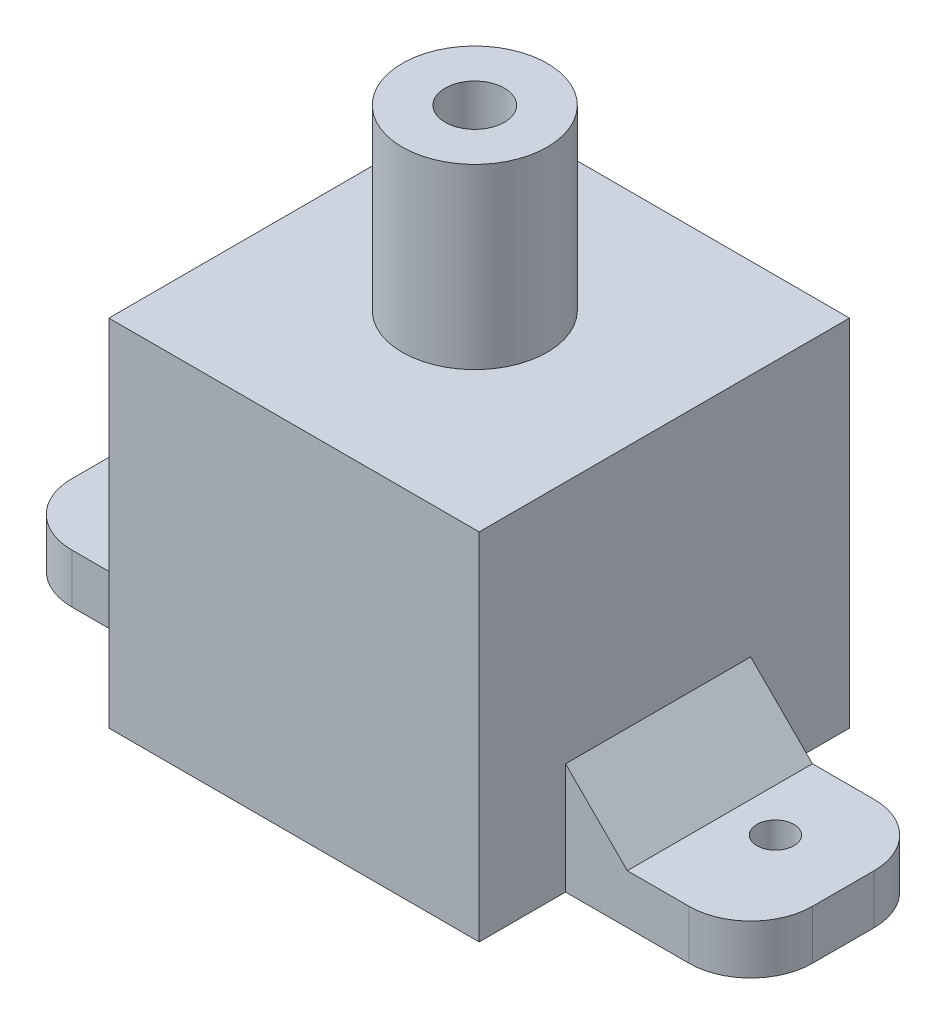
from build123d import *

# Parameters (mm, degrees)
SKETCH_1_W               = 30
SKETCH_1_H               = 30
EXTRUDE_289_DEPTH        = 28.77
SKETCH_2_R               = 5.875
EXTRUDE_2_DEPTH          = 14.4
EXTRUDE_4_DEPTH          = 4
CUT_EXTRUDE_2_DEPTH      = 53.090646066
CUT_EXTRUDE_2_DEPTH_BACK = 53.090646066
SKETCH_6_R               = 1.5
CHAMFER_2_SIZE           = 5
CHAMFER_3_SIZE           = 5
SKETCH_4_R               = 2.4
CUT_EXTRUDE_3_DEPTH      = 8


with BuildPart() as part:
    # Эскиз1 → Extrude 289 (new body)
    with BuildSketch(Plane(origin=(0, 0, 0), x_dir=(1, 0, 0), z_dir=(0, 1, 0))):
        with Locations((0.713469456, -0.356734728)):
            Rectangle(SKETCH_1_W, SKETCH_1_H)
    extrude(amount=EXTRUDE_289_DEPTH)

    # Эскиз2 → Бобышка-Вытянуть2 (add)
    with BuildSketch(Plane(origin=(0, 28.77, 0), x_dir=(1, 0, 0), z_dir=(0, 1, 0))):
        with Locations(Location((0, 0, 0), (0, 0, 270))):
            Circle(SKETCH_2_R)
    extrude(amount=EXTRUDE_2_DEPTH)

    # Эскиз5 → Бобышка-Вытянуть4 (add)
    with BuildSketch(Plane.XZ):
        with BuildLine():
            Line((15.713469456, 8.356734728), (25.713469456, 8.356734728))
            ThreePointArc((25.713469456, 8.356734728), (29.249003362, 6.892268634), (30.713469456, 3.356734728))
            Line((30.713469456, 3.356734728), (30.713469456, -1.643265272))
            ThreePointArc((30.713469456, -1.643265272), (29.249003362, -5.178799178), (25.713469456, -6.643265272))
            Line((25.713469456, -6.643265272), (15.713469456, -6.643265272))
            Line((15.713469456, -6.643265272), (15.713469456, 8.356734728))
        make_face()
        with BuildLine():
            Line((-14.286530544, 8.356734728), (-24.286530544, 8.356734728))
            ThreePointArc((-24.286530544, 8.356734728), (-27.82206445, 6.892268634), (-29.286530544, 3.356734728))
            Line((-29.286530544, 3.356734728), (-29.286530544, -1.643265272))
            ThreePointArc((-29.286530544, -1.643265272), (-27.82206445, -5.178799178), (-24.286530544, -6.643265272))
            Line((-24.286530544, -6.643265272), (-14.286530544, -6.643265272))
            Line((-14.286530544, -6.643265272), (-14.286530544, 8.356734728))
        make_face()
    extrude(amount=-EXTRUDE_4_DEPTH)

    # Эскиз6 → Вырез-Вытянуть2 (cut, two sides: drawn at the far end of the back side and taken through both)
    with BuildSketch(Plane(origin=(0, 4, 0), x_dir=(1, 0, 0), z_dir=(0, 1, 0)).offset(-CUT_EXTRUDE_2_DEPTH_BACK)):
        with Locations(Location((24.213469456, 0.143265272, 0), (0, 0, 270))):
            Circle(SKETCH_6_R)
        with Locations(Location((-22.786530544, 0.143265272, 0), (0, 0, 270))):
            Circle(SKETCH_6_R)
    extrude(amount=CUT_EXTRUDE_2_DEPTH + CUT_EXTRUDE_2_DEPTH_BACK, mode=Mode.SUBTRACT)

    # Фаска2
    chamfer_2_edges = [part.edges().sort_by_distance(p)[0] for p in [
        (15.713469456, 4, 0.856734728),
    ]]
    chamfer(chamfer_2_edges, length=CHAMFER_2_SIZE)

    # Фаска3
    chamfer_3_edges = [part.edges().sort_by_distance(p)[0] for p in [
        (-14.286530544, 4, 0.856734728),
    ]]
    chamfer(chamfer_3_edges, length=CHAMFER_3_SIZE)

    # Эскиз4 → Вырез-Вытянуть3 (cut)
    with BuildSketch(Plane(origin=(0, 43.17, 0), x_dir=(1, 0, 0), z_dir=(0, 1, 0))):
        with Locations(Location((0, 0, 0), (0, 0, 270))):
            Circle(SKETCH_4_R)
    extrude(amount=-CUT_EXTRUDE_3_DEPTH, mode=Mode.SUBTRACT)


solid = part.part
